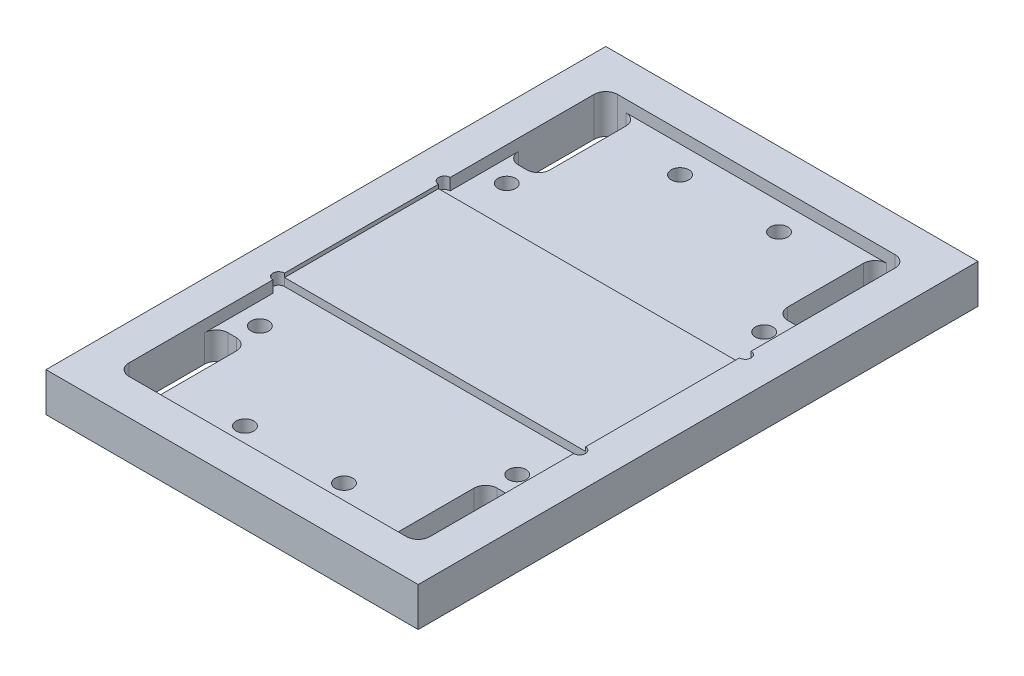
from build123d import *

# Parameters (mm, degrees)
SKETCH1_W                                  = 47.752
SKETCH1_H                                  = 71.816
BOSS_EXTRUDE1_DEPTH                        = 5
SKETCH2_W                                  = 38.608
SKETCH2_H                                  = 62.672
CUT_EXTRUDE1_DEPTH                         = 1.5
SKETCH3_W                                  = 4.064
SKETCH3_H                                  = 12.7
CUT_EXTRUDE2_DEPTH                         = 44.263123327
MIRROR4_AT_THE_SECOND_PLANE_COPY_1_SKETC_W = 4.064
MIRROR4_AT_THE_SECOND_PLANE_COPY_1_SKETC_H = 12.7
MIRROR4_AT_THE_SECOND_PLANE_COPY_1_DEPTH   = 44.263123327
FILLET2_R                                  = 1.5
SKETCH4_R                                  = 1.1303
CUT_EXTRUDE3_DEPTH                         = 44.263123327
MIRROR5_AT_THE_SECOND_PLANE_COPY_1_SKETC_R = 1.1303
MIRROR5_AT_THE_SECOND_PLANE_COPY_1_DEPTH   = 44.263123327
SKETCH5_W                                  = 38.608
SKETCH5_H                                  = 19.75
BOSS_EXTRUDE2_DEPTH                        = 1
CUT_EXTRUDE4_REACH                         = 45.41
MIRROR6_AT_THE_SECOND_PLANE_COPY_1_REACH   = 45.41


with BuildPart() as part:
    # Sketch1 → Boss-Extrude1 (new body)
    with BuildSketch(Plane(origin=(0, 0, 0), x_dir=(1, 0, 0), z_dir=(0, 1, 0))):
        Rectangle(SKETCH1_W, SKETCH1_H)
    extrude(amount=BOSS_EXTRUDE1_DEPTH)

    # Sketch2 → Cut-Extrude1 (cut)
    with BuildSketch(Plane(origin=(0, 5, 0), x_dir=(1, 0, 0), z_dir=(0, 1, 0))):
        Rectangle(SKETCH2_W, SKETCH2_H)
    extrude(amount=-CUT_EXTRUDE1_DEPTH, mode=Mode.SUBTRACT)

    # Sketch3 → Cut-Extrude2 (cut, through all)
    with BuildSketch(Plane(origin=(0, 3.5, 0), x_dir=(1, 0, 0), z_dir=(0, 1, 0))):
        with Locations((-17.272, 24.986)):
            Rectangle(SKETCH3_W, SKETCH3_H)
    cut_extrude2 = extrude(amount=-CUT_EXTRUDE2_DEPTH, mode=Mode.SUBTRACT)

    # Mirror4: Cut-Extrude2 across plane
    add(cut_extrude2.mirror(Plane.XY), mode=Mode.SUBTRACT)

    # Mirror4 at the second plane: Cut-Extrude2 across plane
    add(cut_extrude2.mirror(Plane(origin=(0, 0, 0), x_dir=(0, 0, 1), z_dir=(1, 0, 0))), mode=Mode.SUBTRACT)

    # Mirror4 at the second plane copy 1 sketc → Mirror4 at the second plane copy 1 (cut, through all)
    with BuildSketch(Plane(origin=(0, 3.5, 0), x_dir=(-1, 0, 0), z_dir=(0, 1, 0))):
        with Locations((-17.272, 24.986)):
            Rectangle(MIRROR4_AT_THE_SECOND_PLANE_COPY_1_SKETC_W, MIRROR4_AT_THE_SECOND_PLANE_COPY_1_SKETC_H)
    extrude(amount=-MIRROR4_AT_THE_SECOND_PLANE_COPY_1_DEPTH, mode=Mode.SUBTRACT)

    # Fillet2
    fillet2_edges = [part.edges().sort_by_distance(p)[0] for p in [
        (19.304, 2.5, -31.336),
        (19.304, 2.5, 31.336),
        (-19.304, 2.5, 31.336),
        (-19.304, 2.5, -31.336),
        (-19.304, 1.75, -18.636),
        (-15.24, 1.75, -31.336),
        (-15.24, 1.75, -18.636),
        (19.304, 1.75, -18.636),
        (15.24, 1.75, -18.636),
        (15.24, 1.75, -31.336),
        (-19.304, 1.75, 18.636),
        (-15.24, 1.75, 18.636),
        (-15.24, 1.75, 31.336),
        (19.304, 1.75, 18.636),
        (15.24, 1.75, 31.336),
        (15.24, 1.75, 18.636),
    ]]
    fillet(fillet2_edges, radius=FILLET2_R)

    # Sketch4 → Cut-Extrude3 (cut, through all)
    with BuildSketch(Plane(origin=(0, 3.5, 0), x_dir=(1, 0, 0), z_dir=(0, 1, 0))):
        with Locations(Location((-6.35, 27.907, 0), (0, 0, 270))):
            Circle(SKETCH4_R)
        with Locations(Location((-16.51, 15.842, 0), (0, 0, 270))):
            Circle(SKETCH4_R)
    cut_extrude3 = extrude(amount=-CUT_EXTRUDE3_DEPTH, mode=Mode.SUBTRACT)

    # Mirror5: Cut-Extrude3 across plane
    add(cut_extrude3.mirror(Plane.XY), mode=Mode.SUBTRACT)

    # Mirror5 at the second plane: Cut-Extrude3 across plane
    add(cut_extrude3.mirror(Plane(origin=(0, 0, 0), x_dir=(0, 0, 1), z_dir=(1, 0, 0))), mode=Mode.SUBTRACT)

    # Mirror5 at the second plane copy 1 sketc → Mirror5 at the second plane copy 1 (cut, through all)
    with BuildSketch(Plane(origin=(0, 3.5, 0), x_dir=(-1, 0, 0), z_dir=(0, 1, 0))):
        with Locations(Location((-6.35, 27.907, 0), (0, 0, 270))):
            Circle(MIRROR5_AT_THE_SECOND_PLANE_COPY_1_SKETC_R)
        with Locations(Location((-16.51, 15.842, 0), (0, 0, 270))):
            Circle(MIRROR5_AT_THE_SECOND_PLANE_COPY_1_SKETC_R)
    extrude(amount=-MIRROR5_AT_THE_SECOND_PLANE_COPY_1_DEPTH, mode=Mode.SUBTRACT)

    # Sketch5 → Boss-Extrude2 (add)
    with BuildSketch(Plane(origin=(0, 3.5, 0), x_dir=(1, 0, 0), z_dir=(0, 1, 0))):
        Rectangle(SKETCH5_W, SKETCH5_H)
    extrude(amount=BOSS_EXTRUDE2_DEPTH)

    # Cut-Extrude4: up to this face of the body (flat: up to its plane)
    cut_extrude4_end = Plane(part.part.faces().sort_by_distance((0, 3.5, -19.951636366))[0])
    # Sketch6 → Cut-Extrude4 (cut, up to the picked face)
    with BuildSketch(Plane(origin=(0, 5, 0), x_dir=(1, 0, 0), z_dir=(0, 1, 0)), mode=Mode.PRIVATE) as cut_extrude4_sk1:
        with BuildLine():
            Line((-19.304, 11.375), (-19.304, 9.875))
            ThreePointArc((-19.304, 9.875), (-20.054, 10.625), (-19.304, 11.375))
        make_face()
    cut_extrude4_tool1 = split(extrude(cut_extrude4_sk1.sketch, amount=-CUT_EXTRUDE4_REACH, mode=Mode.PRIVATE), bisect_by=cut_extrude4_end, keep=Keep.BOTH, mode=Mode.PRIVATE)
    cut_extrude4 = cut_extrude4_tool1.solids().sort_by(Axis((-19.62231, 5, -10.625), (0, -1, 0)))[0]
    add(cut_extrude4, mode=Mode.SUBTRACT)

    # Mirror6: Cut-Extrude4 across plane
    add(cut_extrude4.mirror(Plane.XY), mode=Mode.SUBTRACT)

    # Mirror6 at the second plane: Cut-Extrude4 across plane
    add(cut_extrude4.mirror(Plane(origin=(0, 0, 0), x_dir=(0, 0, 1), z_dir=(1, 0, 0))), mode=Mode.SUBTRACT)

    # Mirror6 at the second plane copy 1: up to this face of the body (flat: up to its plane)
    mirror6_at_the_second_plane_copy_1_end = Plane(part.part.faces().sort_by_distance((0, 3.5, 19.951636366))[0])
    # Mirror6 at the second plane copy 1 sketc → Mirror6 at the second plane copy 1 (cut, up to the picked face)
    with BuildSketch(Plane(origin=(0, 5, 0), x_dir=(-1, 0, 0), z_dir=(0, 1, 0)), mode=Mode.PRIVATE) as mirror6_at_the_second_plane_copy_1_sk1:
        with BuildLine():
            Line((-19.304, 11.375), (-19.304, 9.875))
            ThreePointArc((-19.304, 9.875), (-20.054, 10.625), (-19.304, 11.375))
        make_face()
    mirror6_at_the_second_plane_copy_1_tool1 = split(extrude(mirror6_at_the_second_plane_copy_1_sk1.sketch, amount=-MIRROR6_AT_THE_SECOND_PLANE_COPY_1_REACH, mode=Mode.PRIVATE), bisect_by=mirror6_at_the_second_plane_copy_1_end, keep=Keep.BOTH, mode=Mode.PRIVATE)
    add(mirror6_at_the_second_plane_copy_1_tool1.solids().sort_by(Axis((19.62231, 5, 10.625), (0, -1, 0)))[0], mode=Mode.SUBTRACT)


solid = part.part
